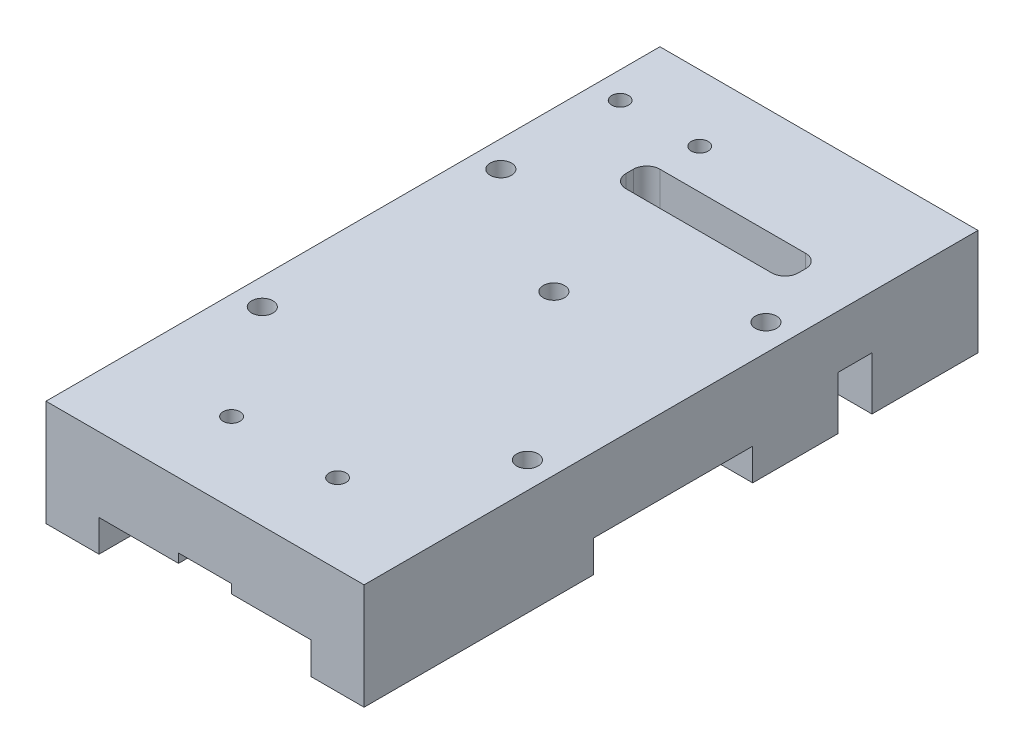
from build123d import *

# Parameters (mm, degrees)
BOSS_EXTRUDE1_DEPTH         = 12.7
BOSS_EXTRUDE1_DEPTH_BACK    = 12.7
SKETCH1_W                   = 76.2
SKETCH1_H                   = 147.066
SKETCH2_R                   = 4.7625
CUT_EXTRUDE1_DEPTH          = 25.4
CUT_EXTRUDE2_DEPTH          = 7.62
CUT_EXTRUDE4_DEPTH          = 84.785452729
CUT_EXTRUDE4_DEPTH_BACK     = 84.785452729
F_1_4_20_TAPPED_HOLE1_D     = 5.1054
F_1_4_20_TAPPED_HOLE1_DEPTH = 19.05
F_1_4_20_TAPPED_HOLE1_TIP   = 1.533816902
SKETCH9_R                   = 2.5527
SKETCH9_R_2                 = 2.0193
CUT_EXTRUDE5_DEPTH          = 87.62489301
CUT_EXTRUDE6_REACH          = 103.385
CUT_EXTRUDE7_DEPTH          = 2.159
SKETCH12_R                  = 2.0193
CUT_EXTRUDE8_DEPTH          = 85.704430162
SKETCH13_W                  = 15.875
SKETCH13_H                  = 8.128
CUT_EXTRUDE9_DEPTH          = 12.7
CUT_EXTRUDE10_DEPTH         = 85.02996052


with BuildPart() as part:
    # Sketch1 → Boss-Extrude1 (new, two sides: drawn at the far end of the back side and taken through both)
    with BuildSketch(Plane(origin=(0, 0, 0), x_dir=(1, 0, 0), z_dir=(0, 1, 0)).offset(-BOSS_EXTRUDE1_DEPTH_BACK)):
        Rectangle(SKETCH1_W, SKETCH1_H)
    extrude(amount=BOSS_EXTRUDE1_DEPTH + BOSS_EXTRUDE1_DEPTH_BACK)

    # Sketch2 → Cut-Extrude1 (cut)
    with BuildSketch(Plane(origin=(0, 0, -73.533), x_dir=(-1, 0, 0), z_dir=(0, 0, -1))):
        with Locations((0, -12.7)):
            Circle(SKETCH2_R)
    extrude(amount=-CUT_EXTRUDE1_DEPTH, mode=Mode.SUBTRACT)

    # Sketch3 → Cut-Extrude2 (cut)
    with BuildSketch(Plane(origin=(0, -12.7, 0), x_dir=(-1, 0, 0), z_dir=(0, -1, 0))):
        with BuildLine():
            Line((-19.05, -83.058), (19.05, -83.058))
            ThreePointArc((19.05, -83.058), (23.540128061, -81.198128061), (25.4, -76.708))
            Line((25.4, -76.708), (25.4, -18.542))
            Line((25.4, -18.542), (44.45, -18.542))
            Line((44.45, -18.542), (44.45, 19.558))
            Line((44.45, 19.558), (-44.45, 19.558))
            Line((-44.45, 19.558), (-44.45, -18.542))
            Line((-44.45, -18.542), (-25.4, -18.542))
            Line((-25.4, -18.542), (-25.4, -76.708))
            ThreePointArc((-25.4, -76.708), (-23.540128061, -81.198128061), (-19.05, -83.058))
        make_face()
    extrude(amount=-CUT_EXTRUDE2_DEPTH, mode=Mode.SUBTRACT)

    # Sketch5 → Cut-Extrude4 (cut, two sides: drawn at the far end of the back side and taken through both)
    with BuildSketch(Plane(origin=(0, 0, 0), x_dir=(1, 0, 0), z_dir=(0, 1, 0)).offset(-CUT_EXTRUDE4_DEPTH_BACK)):
        with BuildLine():
            Line((22.225, 48.133), (-12.7, 48.133))
            ThreePointArc((-12.7, 48.133), (-14.94506403, 47.20306403), (-15.875, 44.958))
            Line((-15.875, 44.958), (-15.875, 43.18))
            ThreePointArc((-15.875, 43.18), (-14.94506403, 40.93493597), (-12.7, 40.005))
            Line((-12.7, 40.005), (22.225, 40.005))
            ThreePointArc((22.225, 40.005), (24.47006403, 40.93493597), (25.4, 43.18))
            Line((25.4, 43.18), (25.4, 44.958))
            ThreePointArc((25.4, 44.958), (24.47006403, 47.20306403), (22.225, 48.133))
        make_face()
    extrude(amount=CUT_EXTRUDE4_DEPTH + CUT_EXTRUDE4_DEPTH_BACK, mode=Mode.SUBTRACT)

    # 1/4-20 Tapped Hole1
    with Locations(Plane(origin=(-11.034450397, 12.7, 14.547513529), x_dir=(-1, 0, 0), z_dir=(0, 1, 0))):
        with Locations((-11.034450397, -24.580513529)):
            Hole(F_1_4_20_TAPPED_HOLE1_D / 2, depth=F_1_4_20_TAPPED_HOLE1_DEPTH)
            with Locations((0, 0, -(F_1_4_20_TAPPED_HOLE1_DEPTH + F_1_4_20_TAPPED_HOLE1_TIP / 2))):  # 118° drill point
                Cone(0, F_1_4_20_TAPPED_HOLE1_D / 2, F_1_4_20_TAPPED_HOLE1_TIP, mode=Mode.SUBTRACT)

    # Sketch9 → Cut-Extrude5 (cut, through all)
    with BuildSketch(Plane(origin=(0, -12.7, 0), x_dir=(-1, 0, 0), z_dir=(0, -1, 0))):
        with Locations((31.75, 29.083)):
            Circle(SKETCH9_R)
        with Locations((31.75, -28.067)):
            Circle(SKETCH9_R)
        with Locations((-31.75, -28.067)):
            Circle(SKETCH9_R)
        with Locations((-31.75, 29.083)):
            Circle(SKETCH9_R)
        with Locations((31.75, 57.658)):
            Circle(SKETCH9_R_2)
        with Locations((12.7, 57.658)):
            Circle(SKETCH9_R_2)
    extrude(amount=-CUT_EXTRUDE5_DEPTH, mode=Mode.SUBTRACT)

    # Sketch10 → Cut-Extrude6 (cut, up to next)
    with BuildSketch(Plane.XY.offset(-19.558), mode=Mode.PRIVATE) as cut_extrude6_sk1:
        with BuildLine():
            Line((-10.939706577, -10.414), (-12.209706577, -10.414))
            Line((-12.209706577, -10.414), (-12.209706577, -14.986))
            Line((-12.209706577, -14.986), (-10.939706577, -14.986))
            ThreePointArc((-10.939706577, -14.986), (0, -23.876), (10.939706577, -14.986))
            Line((10.939706577, -14.986), (12.209706577, -14.986))
            Line((12.209706577, -14.986), (12.209706577, -10.414))
            Line((12.209706577, -10.414), (10.939706577, -10.414))
            Line((10.939706577, -10.414), (10.939706577, -1.524))
            Line((10.939706577, -1.524), (-10.939706577, -1.524))
            Line((-10.939706577, -1.524), (-10.939706577, -10.414))
        make_face()
    cut_extrude6_tool1 = extrude(cut_extrude6_sk1.sketch, amount=-CUT_EXTRUDE6_REACH, mode=Mode.PRIVATE) & part.part
    add(cut_extrude6_tool1.solids().sort_by_distance((0, -11.73366, -19.558))[0], mode=Mode.SUBTRACT)

    # Sketch11 → Cut-Extrude7 (cut)
    with BuildSketch(Plane(origin=(0, -5.08, 0), x_dir=(-1, 0, 0), z_dir=(0, -1, 0))):
        with BuildLine():
            Line((0.00254, -32.893), (-0.00254, -32.893))
            ThreePointArc((-0.00254, -32.893), (-4.490872009, -34.752127991), (-6.35, -39.24046))
            Line((-6.35, -39.24046), (-6.35, -73.533))
            Line((-6.35, -73.533), (6.35, -73.533))
            Line((6.35, -73.533), (6.35, -39.24046))
            ThreePointArc((6.35, -39.24046), (4.490872009, -34.752127991), (0.00254, -32.893))
        make_face()
    extrude(amount=-CUT_EXTRUDE7_DEPTH, mode=Mode.SUBTRACT)

    # Sketch12 → Cut-Extrude8 (cut, through all)
    with BuildSketch(Plane.XZ.offset(5.08)):
        with Locations((12.7, 54.483)):
            Circle(SKETCH12_R)
        with Locations((-12.7, 54.483)):
            Circle(SKETCH12_R)
    extrude(amount=-CUT_EXTRUDE8_DEPTH, mode=Mode.SUBTRACT)

    # Sketch13 → Cut-Extrude9 (cut)
    with BuildSketch(Plane.XZ.offset(12.7)):
        with Locations((30.1625, -44.069)):
            Rectangle(SKETCH13_W, SKETCH13_H)
    extrude(amount=-CUT_EXTRUDE9_DEPTH, mode=Mode.SUBTRACT)

    # Sketch14 → Cut-Extrude10 (cut, through all)
    with BuildSketch(Plane.XZ.offset(1.524)):
        with BuildLine():
            Line((7.764706577, -22.733), (-7.764706577, -22.733))
            ThreePointArc((-7.764706577, -22.733), (-10.939706577, -19.558), (-7.764706577, -16.383))
            Line((-7.764706577, -16.383), (7.764706577, -16.383))
            ThreePointArc((7.764706577, -16.383), (10.939706577, -19.558), (7.764706577, -22.733))
        make_face()
    extrude(amount=CUT_EXTRUDE10_DEPTH, mode=Mode.SUBTRACT)


solid = part.part
